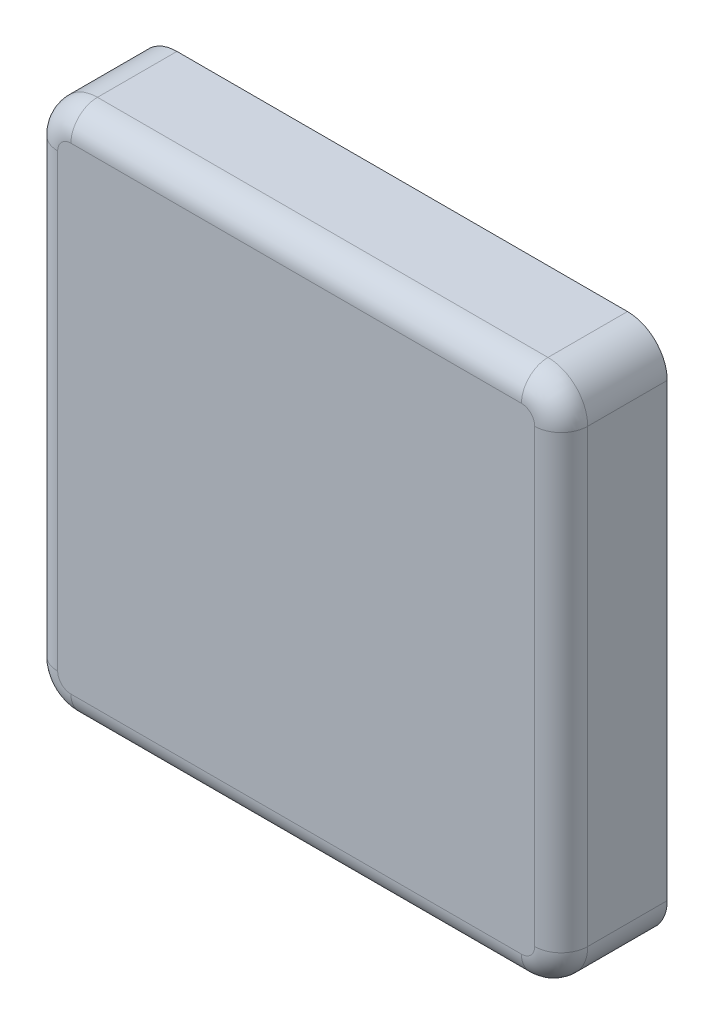
from build123d import *

# Parameters (mm, degrees)
SKETCH1_R           = 4.5
SKETCH1_W           = 3.2
SKETCH1_H           = 3.2
BOSS_EXTRUDE1_DEPTH = 5.1
BOSS_EXTRUDE2_DEPTH = 1
BOSS_EXTRUDE3_START = 3
BOSS_EXTRUDE3_DEPTH = 3
FILLET1_R           = 1


with BuildPart() as part:
    # Sketch1 → Boss-Extrude1 (new body)
    with BuildSketch(Plane.XY):
        Circle(SKETCH1_R)
        Rectangle(SKETCH1_W, SKETCH1_H, mode=Mode.SUBTRACT)
    extrude(amount=BOSS_EXTRUDE1_DEPTH)

    # Sketch2 → Boss-Extrude2 (add)
    with BuildSketch(Plane.XY.offset(5.1)):
        with BuildLine():
            Line((-8.5, -10), (8.5, -10))
            ThreePointArc((8.5, -10), (9.560660172, -9.560660172), (10, -8.5))
            Line((10, -8.5), (10, 8.5))
            ThreePointArc((10, 8.5), (9.560660172, 9.560660172), (8.5, 10))
            Line((8.5, 10), (-8.5, 10))
            ThreePointArc((-8.5, 10), (-9.560660172, 9.560660172), (-10, 8.5))
            Line((-10, 8.5), (-10, -8.5))
            ThreePointArc((-10, -8.5), (-9.560660172, -9.560660172), (-8.5, -10))
        make_face()
    extrude(amount=BOSS_EXTRUDE2_DEPTH)

    # Sketch3 → Boss-Extrude3 (add)
    with BuildSketch(Plane(origin=(0, 0, 5.1), x_dir=(-1, 0, 0), z_dir=(0, 0, -1)).offset(BOSS_EXTRUDE3_START)):
        with BuildLine():
            Line((-8.5, -10), (8.5, -10))
            ThreePointArc((8.5, -10), (9.560660172, -9.560660172), (10, -8.5))
            Line((10, -8.5), (10, 8.5))
            ThreePointArc((10, 8.5), (9.560660172, 9.560660172), (8.5, 10))
            Line((8.5, 10), (-8.5, 10))
            ThreePointArc((-8.5, 10), (-9.560660172, 9.560660172), (-10, 8.5))
            Line((-10, 8.5), (-10, -8.5))
            ThreePointArc((-10, -8.5), (-9.560660172, -9.560660172), (-8.5, -10))
        make_face()
        with BuildLine():
            Line((8.5, 9), (-8.5, 9))
            ThreePointArc((-8.5, 9), (-8.853553391, 8.853553391), (-9, 8.5))
            Line((-9, 8.5), (-9, -8.5))
            ThreePointArc((-9, -8.5), (-8.853553391, -8.853553391), (-8.5, -9))
            Line((-8.5, -9), (8.5, -9))
            ThreePointArc((8.5, -9), (8.853553391, -8.853553391), (9, -8.5))
            Line((9, -8.5), (9, 8.5))
            ThreePointArc((9, 8.5), (8.853553391, 8.853553391), (8.5, 9))
        make_face(mode=Mode.SUBTRACT)
    extrude(amount=-BOSS_EXTRUDE3_DEPTH)

    # Fillet1
    fillet1_edges = [part.edges().sort_by_distance(p)[0] for p in [
        (9.560660172, -9.560660172, 6.1),
        (10, 0, 6.1),
        (9.560660172, 9.560660172, 6.1),
        (0, 10, 6.1),
        (-9.560660172, 9.560660172, 6.1),
        (-10, 0, 6.1),
        (-9.560660172, -9.560660172, 6.1),
        (0, -10, 6.1),
    ]]
    fillet(fillet1_edges, radius=FILLET1_R)


solid = part.part
